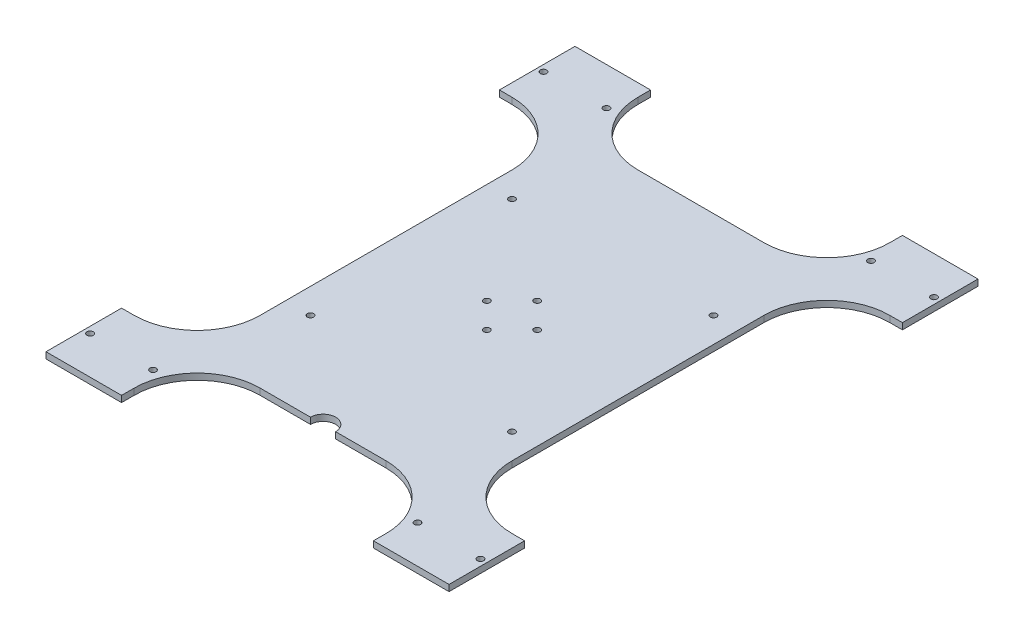
from build123d import *

# Parameters (mm, degrees)
SKETCH1_R               = 2.5
BOSS_EXTRUDE1_DEPTH     = 5
CUT_EXTRUDE2_DEPTH      = 445.100213916
CUT_EXTRUDE2_DEPTH_BACK = 445.100213916


with BuildPart() as part:
    # Sketch1 → Boss-Extrude1 (new body)
    with BuildSketch(Plane(origin=(0, 0, 0), x_dir=(1, 0, 0), z_dir=(0, 1, 0))):
        with BuildLine():
            Line((50, 0), (150, 0))
            ThreePointArc((150, 0), (185.355339059, -14.644660941), (200, -50))
            Line((200, -50), (200, -60))
            Line((200, -60), (260, -60))
            Line((260, -60), (260, 0))
            Line((260, 0), (250, 0))
            ThreePointArc((250, 0), (214.644660941, 14.644660941), (200, 50))
            Line((200, 50), (200, 250))
            ThreePointArc((200, 250), (214.644660941, 285.355339059), (250, 300))
            Line((250, 300), (260, 300))
            Line((260, 300), (260, 360))
            Line((260, 360), (200, 360))
            Line((200, 360), (200, 350))
            ThreePointArc((200, 350), (185.355339059, 314.644660941), (150, 300))
            Line((150, 300), (50, 300))
            ThreePointArc((50, 300), (14.644660941, 314.644660941), (0, 350))
            Line((0, 350), (0, 360))
            Line((0, 360), (-60, 360))
            Line((-60, 360), (-60, 300))
            Line((-60, 300), (-50, 300))
            ThreePointArc((-50, 300), (-14.644660941, 285.355339059), (0, 250))
            Line((0, 250), (0, 50))
            ThreePointArc((0, 50), (-14.644660941, 14.644660941), (-50, 0))
            Line((-50, 0), (-60, 0))
            Line((-60, 0), (-60, -60))
            Line((-60, -60), (0, -60))
            Line((0, -60), (0, -50))
            ThreePointArc((0, -50), (14.644660941, -14.644660941), (50, 0))
        make_face()
        with Locations(Location((20, 230, 0), (0, 0, 270))):
            Circle(SKETCH1_R, mode=Mode.SUBTRACT)
        with Locations(Location((20, 70, 0), (0, 0, 270))):
            Circle(SKETCH1_R, mode=Mode.SUBTRACT)
        with Locations(Location((180, 70, 0), (0, 0, 270))):
            Circle(SKETCH1_R, mode=Mode.SUBTRACT)
        with Locations(Location((180, 230, 0), (0, 0, 270))):
            Circle(SKETCH1_R, mode=Mode.SUBTRACT)
        with Locations(Location((-55, -30, 0), (0, 0, 270))):
            Circle(SKETCH1_R, mode=Mode.SUBTRACT)
        with Locations(Location((-5, -30, 0), (0, 0, 270))):
            Circle(SKETCH1_R, mode=Mode.SUBTRACT)
        with Locations(Location((-55, 330, 0), (0, 0, 270))):
            Circle(SKETCH1_R, mode=Mode.SUBTRACT)
        with Locations(Location((-5, 330, 0), (0, 0, 270))):
            Circle(SKETCH1_R, mode=Mode.SUBTRACT)
        with Locations(Location((205, 330, 0), (0, 0, 270))):
            Circle(SKETCH1_R, mode=Mode.SUBTRACT)
        with Locations(Location((255, 330, 0), (0, 0, 270))):
            Circle(SKETCH1_R, mode=Mode.SUBTRACT)
        with Locations(Location((205, -30, 0), (0, 0, 270))):
            Circle(SKETCH1_R, mode=Mode.SUBTRACT)
        with Locations(Location((255, -30, 0), (0, 0, 270))):
            Circle(SKETCH1_R, mode=Mode.SUBTRACT)
        with Locations(Location((100, 170, 0), (0, 0, 270))):
            Circle(SKETCH1_R, mode=Mode.SUBTRACT)
        with Locations(Location((120, 150, 0), (0, 0, 270))):
            Circle(SKETCH1_R, mode=Mode.SUBTRACT)
        with Locations(Location((80, 150, 0), (0, 0, 270))):
            Circle(SKETCH1_R, mode=Mode.SUBTRACT)
        with Locations(Location((100, 130, 0), (0, 0, 270))):
            Circle(SKETCH1_R, mode=Mode.SUBTRACT)
    extrude(amount=BOSS_EXTRUDE1_DEPTH)

    # Sketch3 → Cut-Extrude2 (cut, two sides: drawn at the far end of the back side and taken through both)
    with BuildSketch(Plane(origin=(0, 5, 0), x_dir=(1, 0, 0), z_dir=(0, 1, 0)).offset(-CUT_EXTRUDE2_DEPTH_BACK)):
        with BuildLine():
            Line((110, -806.241169496), (110, 0))
            ThreePointArc((110, 0), (100, 10), (90, 0))
            Line((90, 0), (90, -806.241169496))
            Line((90, -806.241169496), (90, -2418.723508487))
            Line((90, -2418.723508487), (110, -2418.723508487))
            Line((110, -2418.723508487), (110, -806.241169496))
        make_face()
    extrude(amount=CUT_EXTRUDE2_DEPTH + CUT_EXTRUDE2_DEPTH_BACK, mode=Mode.SUBTRACT)


solid = part.part
